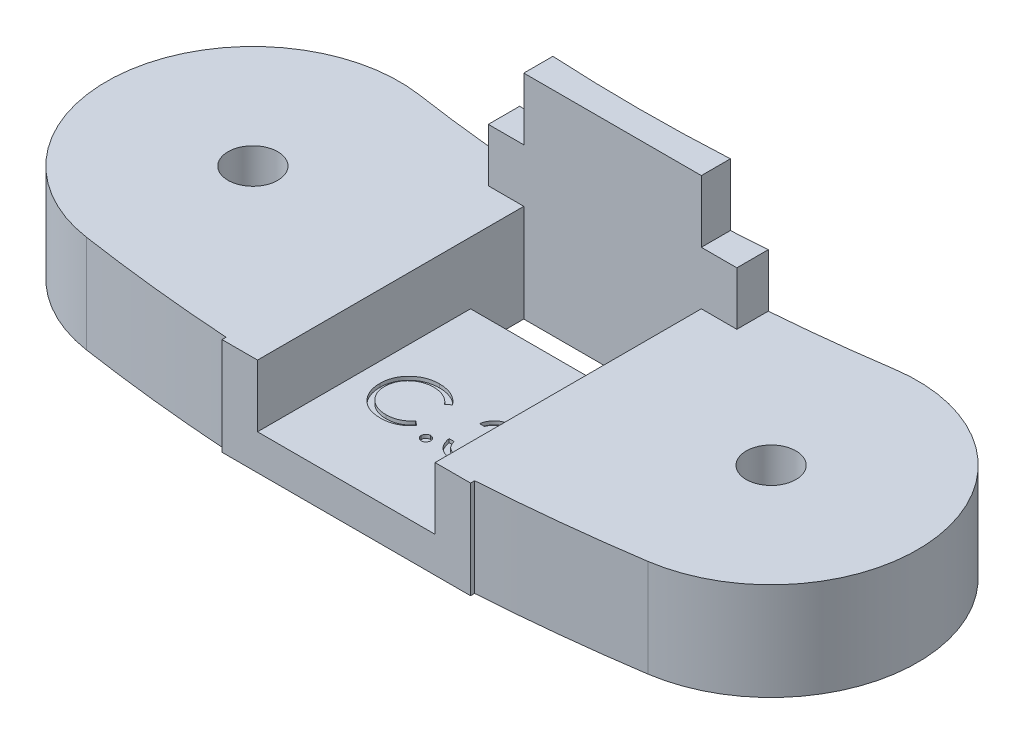
from build123d import *

# Parameters (mm, degrees)
SKETCH2_R                = 1.4
BOSS_EXTRUDE1_DEPTH      = 14
BOSS_EXTRUDE2_REACH      = 34.049
BOSS_EXTRUDE2_END_RADIUS = 107
SKETCH3_W                = 14
SKETCH3_H                = 14
SKETCH19_W               = 15.846179349
SKETCH19_H               = 3
CUT_EXTRUDE4_DEPTH       = 22
CUT_EXTRUDE8_DEPTH       = 33.049477443
SKETCH25_W               = 10
SKETCH25_H               = 3
CUT_EXTRUDE9_DEPTH       = 2
BOSS_EXTRUDE3_DEPTH      = 3
BOSS_EXTRUDE3_DEPTH_BACK = 3.5
BOSS_EXTRUDE4_DEPTH      = 3.5
CUT_EXTRUDE10_DEPTH      = 0.2


with BuildPart() as part:
    # Sketch2 → Boss-Extrude1 (new body)
    with BuildSketch(Plane(origin=(0, 0, 0), x_dir=(1, 0, 0), z_dir=(0, 1, 0))):
        with BuildLine():
            ThreePointArc((-13.376751707, 15.494064366), (0, 14.5), (13.376751707, 15.494064366))
            ThreePointArc((13.376751707, 15.494064366), (22.755560222, 8.554111135), (15.815606991, -0.82469738))
            ThreePointArc((15.815606991, -0.82469738), (0, -2), (-15.815606991, -0.82469738))
            ThreePointArc((-15.815606991, -0.82469738), (-22.755560222, 8.554111135), (-13.376751707, 15.494064366))
        make_face()
        with Locations(Location((-14.596179349, 7.334683493, 0), (0, 0, 270))):
            Circle(SKETCH2_R, mode=Mode.SUBTRACT)
        with Locations(Location((14.596179349, 7.334683493, 0), (0, 0, 270))):
            Circle(SKETCH2_R, mode=Mode.SUBTRACT)
    extrude(amount=BOSS_EXTRUDE1_DEPTH)

    # Boss-Extrude2: up to this cylinder (the profile starts outside it)
    boss_extrude2_end = Plane(origin=(0, 7, -105), z_dir=(0, -1, 0)) * Cylinder(BOSS_EXTRUDE2_END_RADIUS, 283.098, mode=Mode.PRIVATE)
    # Sketch3 → Boss-Extrude2 (add, up to the surface)
    with BuildSketch(Plane.XY.offset(2), mode=Mode.PRIVATE) as boss_extrude2_sk1:
        with Locations((0, 7)):
            Rectangle(SKETCH3_W, SKETCH3_H)
    boss_extrude2_tool1 = extrude(boss_extrude2_sk1.sketch, amount=-BOSS_EXTRUDE2_REACH, mode=Mode.PRIVATE) - boss_extrude2_end
    add(boss_extrude2_tool1.solids().sort_by_distance((0, 7, 2))[0])
    add(boss_extrude2_tool1.solids().sort_by_distance((0, 7, 2))[1])

    # Sketch19 → Cut-Extrude4 (cut)
    with BuildSketch(Plane.XY.offset(2)):
        with Locations((-14.923089674, 7)):
            Rectangle(SKETCH19_W, SKETCH19_H)
    cut_extrude4 = extrude(amount=-CUT_EXTRUDE4_DEPTH, mode=Mode.SUBTRACT)

    # Mirror2: Cut-Extrude4 across plane
    add(cut_extrude4.mirror(Plane(origin=(0, 0, 0), x_dir=(0, 0, 1), z_dir=(1, 0, 0))), mode=Mode.SUBTRACT)

    # Sketch24 → Cut-Extrude8 (cut, through all)
    with BuildSketch(Plane.XY.offset(2)):
        Polygon((-5, 8.5), (-7, 8.5), (-7, 5.5), (-5, 5.5), (-5, 2), (5, 2), (5, 5.5), (7, 5.5), (7, 8.5), (5, 8.5), (5, 12), (-5, 12), align=None)
    extrude(amount=-CUT_EXTRUDE8_DEPTH, mode=Mode.SUBTRACT)


with BuildPart() as cut_extrude8_kept_piece:
    # of the separate pieces the step leaves, the one the design keeps (cut_extrude8_pieces_kept)
    add(part.part.solids().sort_by_distance((-13.376751707, 0, -15.494064366))[0])

    # Sketch25 → Cut-Extrude9 (cut)
    with BuildSketch(Plane(origin=(0, 2, 0), x_dir=(1, 0, 0), z_dir=(0, 1, 0))):
        with Locations((0, 11.5)):
            Rectangle(SKETCH25_W, SKETCH25_H)
    extrude(amount=-CUT_EXTRUDE9_DEPTH, mode=Mode.SUBTRACT)

    # Sketch26 → Boss-Extrude3 (add, two sides: drawn at the far end of the back side and taken through both)
    with BuildSketch(Plane(origin=(0, 5.5, 0), x_dir=(1, 0, 0), z_dir=(0, 1, 0)).offset(-BOSS_EXTRUDE3_DEPTH_BACK)):
        with BuildLine():
            Line((-7, 14.771124356), (-7, 13))
            Line((-7, 13), (-5, 13))
            Line((-5, 13), (-5, 14.638227109))
            ThreePointArc((-5, 14.638227109), (-6.00036794, 14.699138517), (-7, 14.771124356))
        make_face()
        with BuildLine():
            Line((-5, 14.638227109), (-5, 13))
            Line((-5, 13), (0, 13))
            Line((0, 13), (0, 14.5))
            ThreePointArc((0, 14.5), (-2.500955154, 14.534563377), (-5, 14.638227109))
        make_face()
        with BuildLine():
            Line((0, 14.5), (0, 13))
            Line((0, 13), (5, 13))
            Line((5, 13), (7, 13))
            Line((7, 13), (7, 14.771124356))
            ThreePointArc((7, 14.771124356), (6.00036794, 14.699138517), (5, 14.638227109))
            ThreePointArc((5, 14.638227109), (2.500955154, 14.534563377), (0, 14.5))
        make_face()
    extrude(amount=BOSS_EXTRUDE3_DEPTH + BOSS_EXTRUDE3_DEPTH_BACK)

    # Sketch27 → Boss-Extrude4 (add)
    with BuildSketch(Plane(origin=(0, 8.5, 0), x_dir=(1, 0, 0), z_dir=(0, 1, 0))):
        with BuildLine():
            Line((-5, 14.638227109), (-5, 13))
            Line((-5, 13), (5, 13))
            Line((5, 13), (5, 14.638227109))
            ThreePointArc((5, 14.638227109), (0, 14.5), (-5, 14.638227109))
        make_face()
    extrude(amount=BOSS_EXTRUDE4_DEPTH)

    # Sketch28 → Cut-Extrude10 (cut)
    with BuildSketch(Plane(origin=(0, 2, 0), x_dir=(1, 0, 0), z_dir=(0, 1, 0))):
        with BuildLine():
            Line((-0.823224652, 4.80195246), (-1.072543562, 4.611147172))
            add(Edge.make_bspline(
                [(-1.072543562, 4.611147172), (-1.090328904, 4.632343444), (-1.125659802, 4.674450218), (-1.18250065, 4.733577376), (-1.241738569, 4.788972292), (-1.303350915, 4.840898854), (-1.368446688, 4.887541206), (-1.435448983, 4.931329992), (-1.505478639, 4.970580011), (-1.602317712, 5.018171435), (-1.72899826, 5.067834018), (-1.888469293, 5.109474806), (-2.054940075, 5.135982587), (-2.168512183, 5.138853551), (-2.22627954, 5.140313838)],
                knots=[0, 0, 0, 0, 0.757959112, 1.505699292, 2.245454638, 2.979532153, 3.711538275, 4.438200793, 5.171680507, 5.909471876, 7.393775596, 8.890124382, 10.418191784, 12, 12, 12, 12], degree=3))
            add(Edge.make_bspline(
                [(-2.22627954, 5.140313838), (-2.258105104, 5.139947387), (-2.321460862, 5.139217884), (-2.415484834, 5.129593892), (-2.507753102, 5.116067294), (-2.598205647, 5.095996466), (-2.68672733, 5.070621304), (-2.773896867, 5.040299678), (-2.858452196, 5.002784931), (-2.941563027, 4.961321009), (-3.021191311, 4.914487542), (-3.096534104, 4.863403287), (-3.167316618, 4.808639892), (-3.233594845, 4.749992103), (-3.295436541, 4.687724039), (-3.352393601, 4.6211721), (-3.404268938, 4.550549057), (-3.452090811, 4.47678618), (-3.494919504, 4.400098326), (-3.530778752, 4.320201655), (-3.562533399, 4.238464362), (-3.587660569, 4.153962952), (-3.607549238, 4.067292014), (-3.621272189, 3.978218942), (-3.630786731, 3.886929818), (-3.631512606, 3.825054228), (-3.631878498, 3.793864519)],
                knots=[0, 0, 0, 0, 1.054917814, 2.100044995, 3.131103042, 4.146048494, 5.169673617, 6.183595914, 7.203665975, 8.234915748, 9.262203917, 10.264457458, 11.251630812, 12.227803204, 13.197192746, 14.159520551, 15.12972552, 16.100847026, 17.073214652, 18.039054194, 19.002613845, 19.979014051, 20.95965708, 21.949030935, 22.966165397, 24, 24, 24, 24], degree=3))
            add(Edge.make_bspline(
                [(-3.631878498, 3.793864519), (-3.630733848, 3.746936822), (-3.62848648, 3.654800513), (-3.608485491, 3.519844316), (-3.578091587, 3.390557705), (-3.532538885, 3.267748848), (-3.47636946, 3.149903409), (-3.405394048, 3.039015306), (-3.323191904, 2.933408851), (-3.228600109, 2.835579892), (-3.12481769, 2.746213869), (-3.013467799, 2.667518699), (-2.894827766, 2.60191877), (-2.770207538, 2.54733059), (-2.638648134, 2.50536913), (-2.500386135, 2.475828818), (-2.355722254, 2.456559125), (-2.256871441, 2.45471428), (-2.206562994, 2.453775377)],
                knots=[0, 0, 0, 0, 1.029171465, 2.020641659, 2.987623507, 3.938342917, 4.889210282, 5.84687017, 6.821220943, 7.821438502, 8.827599549, 9.822697543, 10.807740252, 11.797342354, 12.80366471, 13.83203677, 14.896651826, 16, 16, 16, 16], degree=3))
            add(Edge.make_bspline(
                [(-2.206562994, 2.453775377), (-2.151134126, 2.455307341), (-2.042036854, 2.458322614), (-1.882045859, 2.483867076), (-1.7288877, 2.52528533), (-1.582554139, 2.583249873), (-1.44345771, 2.658601956), (-1.31138074, 2.749949316), (-1.186211744, 2.858160875), (-1.110944938, 2.940786285), (-1.072543562, 2.982942044)],
                knots=[0, 0, 0, 0, 1.028121516, 2.023589091, 2.998037872, 3.967518031, 4.937445131, 5.927275754, 6.942489185, 8, 8, 8, 8], degree=3))
            Line((-1.072543562, 2.982942044), (-0.823224652, 2.794044808))
            add(Edge.make_bspline(
                [(-0.823224652, 2.794044808), (-0.843288938, 2.768156355), (-0.883321402, 2.716503454), (-0.948144031, 2.643685546), (-1.016431294, 2.575192599), (-1.088690402, 2.511576828), (-1.164090113, 2.451565277), (-1.243984282, 2.396862902), (-1.327322619, 2.346706171), (-1.413822753, 2.300780318), (-1.503392781, 2.260033958), (-1.595925375, 2.225150898), (-1.691021683, 2.195101891), (-1.788686051, 2.170380491), (-1.889121059, 2.151084579), (-1.991964275, 2.138185303), (-2.097437662, 2.129347995), (-2.168595237, 2.128542528), (-2.204654941, 2.128134351)],
                knots=[0, 0, 0, 0, 0.986787822, 1.968848986, 2.935600012, 3.899624008, 4.868462664, 5.837806735, 6.815139263, 7.798259679, 8.787526145, 9.778297419, 10.776456485, 11.791383307, 12.812564526, 13.85620153, 14.913611965, 16, 16, 16, 16], degree=3))
            add(Edge.make_bspline(
                [(-2.204654941, 2.128134351), (-2.238803124, 2.128372016), (-2.306326929, 2.128841968), (-2.406020797, 2.136454863), (-2.503075631, 2.14684141), (-2.597214041, 2.162480672), (-2.688949747, 2.180935895), (-2.777451134, 2.20567482), (-2.863589075, 2.233387279), (-2.947017499, 2.265958231), (-3.027807369, 2.302712196), (-3.105698112, 2.344251682), (-3.180653905, 2.390227373), (-3.253411679, 2.439625847), (-3.32289663, 2.494033828), (-3.389710899, 2.552695704), (-3.454229146, 2.615413756), (-3.494145867, 2.660639231), (-3.514215237, 2.683377741)],
                knots=[0, 0, 0, 0, 1.114604814, 2.203992996, 3.262667896, 4.300477797, 5.318619304, 6.316056647, 7.298880507, 8.271930387, 9.238335007, 10.195173496, 11.151986948, 12.108099108, 13.064862484, 14.031167946, 15.010108607, 16, 16, 16, 16], degree=3))
            add(Edge.make_bspline(
                [(-3.514215237, 2.683377741), (-3.546360428, 2.722875819), (-3.610262725, 2.801395121), (-3.692019595, 2.928654547), (-3.762003449, 3.061522136), (-3.81858732, 3.200695929), (-3.862822085, 3.34586363), (-3.893466455, 3.497098418), (-3.913379696, 3.654259051), (-3.915656886, 3.761153852), (-3.916814396, 3.815489119)],
                knots=[0, 0, 0, 0, 0.994628077, 1.977248131, 2.950237994, 3.925870899, 4.908910175, 5.911660606, 6.938484602, 8, 8, 8, 8], degree=3))
            add(Edge.make_bspline(
                [(-3.916814396, 3.815489119), (-3.915403613, 3.872598709), (-3.912627986, 3.984958262), (-3.889046086, 4.149853205), (-3.851110464, 4.307833403), (-3.797229, 4.458603942), (-3.728916289, 4.602957839), (-3.644527861, 4.739792361), (-3.545044096, 4.869982601), (-3.431245231, 4.991553125), (-3.306452005, 5.102713824), (-3.172812796, 5.200509451), (-3.030589172, 5.281896055), (-2.881347978, 5.349928288), (-2.723971681, 5.402220051), (-2.558796054, 5.438826156), (-2.386131467, 5.461610969), (-2.268327695, 5.464491336), (-2.208471046, 5.465954864)],
                knots=[0, 0, 0, 0, 1.032925535, 2.032216505, 3.007276963, 3.968222605, 4.92396291, 5.891752235, 6.871517503, 7.883894988, 8.900124299, 9.891468569, 10.874487609, 11.85992873, 12.854644235, 13.869047385, 14.917252991, 16, 16, 16, 16], degree=3))
            add(Edge.make_bspline(
                [(-2.208471046, 5.465954864), (-2.171990775, 5.465517496), (-2.099781753, 5.464651769), (-1.992963275, 5.456209769), (-1.888966307, 5.442136712), (-1.787719202, 5.42298142), (-1.6887294, 5.399207636), (-1.592753468, 5.368237508), (-1.49922823, 5.332825797), (-1.408743535, 5.292042046), (-1.321733522, 5.246261502), (-1.23822529, 5.195991615), (-1.158882168, 5.141294706), (-1.083145855, 5.082635968), (-1.012283293, 5.018774418), (-0.944282523, 4.951466599), (-0.88145283, 4.878773772), (-0.842669575, 4.82760644), (-0.823224652, 4.80195246)],
                knots=[0, 0, 0, 0, 1.096760587, 2.17092713, 3.219439832, 4.250915756, 5.268269357, 6.278326846, 7.281116186, 8.274029601, 9.260640565, 10.235837813, 11.203064059, 12.156899882, 13.114053108, 14.069676657, 15.032185724, 16, 16, 16, 16], degree=3))
        make_face()
        with BuildLine():
            add(Edge.make_bspline(
                [(0.051935604, 2.698006146), (0.069616011, 2.696955523), (0.104276381, 2.694895901), (0.154386162, 2.680765632), (0.199738461, 2.655675276), (0.240135568, 2.62223547), (0.273433586, 2.581690118), (0.299418106, 2.536699544), (0.313425285, 2.486170242), (0.315469905, 2.451309037), (0.316518938, 2.433422813)],
                knots=[0, 0, 0, 0, 1.020151414, 1.999887582, 2.974338812, 3.990962822, 5.007586832, 5.987933904, 6.967670073, 8, 8, 8, 8], degree=3))
            add(Edge.make_bspline(
                [(0.316518938, 2.433422813), (0.315434357, 2.415966364), (0.31329558, 2.381542502), (0.299450214, 2.331394318), (0.273235554, 2.286375626), (0.240365239, 2.245280115), (0.199728474, 2.211769468), (0.154278942, 2.186892577), (0.104394015, 2.171750567), (0.069635636, 2.169821712), (0.051935604, 2.168839479)],
                knots=[0, 0, 0, 0, 1.009421747, 1.99056486, 2.972319754, 3.999869655, 5.017953583, 5.993804169, 6.978383603, 8, 8, 8, 8], degree=3))
            add(Edge.make_bspline(
                [(0.051935604, 2.168839479), (0.034222818, 2.169786171), (-0.000357179, 2.171634361), (-0.050055903, 2.187203478), (-0.095782224, 2.211536189), (-0.136411077, 2.2453426), (-0.169556691, 2.286164158), (-0.194616859, 2.331704359), (-0.209666494, 2.381398949), (-0.211645765, 2.415938089), (-0.212647729, 2.433422813)],
                knots=[0, 0, 0, 0, 1.022052826, 1.995314843, 2.982371812, 4.00089066, 5.028879526, 6.005146991, 6.990147033, 8, 8, 8, 8], degree=3))
            add(Edge.make_bspline(
                [(-0.212647729, 2.433422813), (-0.211684253, 2.451338321), (-0.209803185, 2.486316153), (-0.194585265, 2.536389629), (-0.16975113, 2.581899571), (-0.13618195, 2.622173611), (-0.095792053, 2.655907807), (-0.05016621, 2.680459441), (-0.000237484, 2.695010386), (0.03424296, 2.696990241), (0.051935604, 2.698006146)],
                knots=[0, 0, 0, 0, 1.032775665, 2.016367738, 2.991239715, 4.008302682, 5.025365648, 6.011011707, 6.979408107, 8, 8, 8, 8], degree=3))
        make_face()
        with BuildLine():
            Line((1.130621502, 4.6518523), (0.845685604, 4.6518523))
            add(Edge.make_bspline(
                [(0.845685604, 4.6518523), (0.853404982, 4.683813196), (0.868495735, 4.746294134), (0.899971391, 4.835563578), (0.934260715, 4.920039915), (0.975435117, 4.998141353), (1.02034663, 5.071437501), (1.071802242, 5.138265921), (1.12742799, 5.200326254), (1.188954908, 5.255401834), (1.253478766, 5.305274488), (1.321908742, 5.347796861), (1.392868082, 5.384376629), (1.466848424, 5.414512125), (1.544070022, 5.43721385), (1.623834752, 5.453684666), (1.706351641, 5.464380891), (1.762365527, 5.465424798), (1.7908078, 5.465954864)],
                knots=[0, 0, 0, 0, 1.162005537, 2.271625781, 3.343758855, 4.383309926, 5.390229558, 6.379919256, 7.361854164, 8.333198761, 9.295911338, 10.242430842, 11.177959212, 12.116337295, 13.062827104, 14.020064771, 14.994644689, 16, 16, 16, 16], degree=3))
            add(Edge.make_bspline(
                [(1.7908078, 5.465954864), (1.832248573, 5.464703705), (1.914226176, 5.462228679), (2.034661225, 5.439627726), (2.15079984, 5.403863499), (2.2613708, 5.354448046), (2.364076093, 5.293499555), (2.455458205, 5.220960115), (2.534278497, 5.13822932), (2.600404111, 5.046850494), (2.652179289, 4.949191567), (2.690357642, 4.848679996), (2.713600167, 4.745554208), (2.716612386, 4.67592439), (2.718121502, 4.64104)],
                knots=[0, 0, 0, 0, 1.083050992, 2.142477498, 3.193116406, 4.255571735, 5.30263384, 6.308962982, 7.297363603, 8.282367274, 9.249857812, 10.179914175, 11.08814088, 12, 12, 12, 12], degree=3))
            add(Edge.make_bspline(
                [(2.718121502, 4.64104), (2.717065958, 4.607469551), (2.715000424, 4.541777391), (2.697461991, 4.44587289), (2.667946952, 4.355483724), (2.627062239, 4.270229384), (2.574138119, 4.190650422), (2.510027887, 4.116567792), (2.434279043, 4.047652913), (2.376876007, 4.008174534), (2.347323224, 3.987849896)],
                knots=[0, 0, 0, 0, 1.024540389, 2.004866551, 2.965041327, 3.920577974, 4.882998113, 5.874504559, 6.905732034, 8, 8, 8, 8], degree=3))
            add(Edge.make_bspline(
                [(2.347323224, 3.987849896), (2.381097745, 3.971541126), (2.448014838, 3.939228736), (2.539228532, 3.875859585), (2.622030605, 3.802692755), (2.66820755, 3.745594777), (2.691408761, 3.716906386)],
                knots=[0, 0, 0, 0, 1.015518401, 2.012035669, 3.001164323, 4, 4, 4, 4], degree=3))
            add(Edge.make_bspline(
                [(2.691408761, 3.716906386), (2.706686265, 3.695989712), (2.736991092, 3.654498887), (2.774397612, 3.587790844), (2.808333023, 3.520343422), (2.834776436, 3.450348818), (2.855254158, 3.378618298), (2.869891844, 3.305028696), (2.878985172, 3.229519918), (2.880287423, 3.178436454), (2.880942014, 3.15275875)],
                knots=[0, 0, 0, 0, 1.025084078, 2.033381695, 3.024893161, 4.013698104, 4.991890475, 5.976764909, 6.982997093, 8, 8, 8, 8], degree=3))
            add(Edge.make_bspline(
                [(2.880942014, 3.15275875), (2.879314134, 3.108299932), (2.876066035, 3.019591519), (2.847033767, 2.888532307), (2.802027471, 2.760420601), (2.738112964, 2.637888426), (2.660218867, 2.523243366), (2.56754758, 2.420667), (2.461152053, 2.33249398), (2.342492642, 2.258824702), (2.213934962, 2.199934872), (2.076434246, 2.159061335), (1.931971697, 2.132440321), (1.832905077, 2.129585661), (1.782539571, 2.128134351)],
                knots=[0, 0, 0, 0, 0.955779014, 1.907060117, 2.875433937, 3.871313158, 4.872415639, 5.851225146, 6.836215519, 7.83643374, 8.849228613, 9.86973379, 10.916971861, 12, 12, 12, 12], degree=3))
            add(Edge.make_bspline(
                [(1.782539571, 2.128134351), (1.74859492, 2.128921945), (1.681803166, 2.130471666), (1.583610849, 2.141065826), (1.489883308, 2.160415187), (1.400493815, 2.186453186), (1.315362961, 2.219465695), (1.234750523, 2.260576228), (1.158160548, 2.308937376), (1.086315785, 2.365119988), (1.019224799, 2.427968061), (0.958670542, 2.498597305), (0.903643444, 2.575702093), (0.855616907, 2.660178008), (0.812403386, 2.750933349), (0.776860661, 2.849130201), (0.745577324, 2.953890707), (0.731032681, 3.026895514), (0.72357022, 3.0643523)],
                knots=[0, 0, 0, 0, 1.048658725, 2.063410685, 3.046034179, 4.001477787, 4.936774919, 5.862367409, 6.792675028, 7.730719943, 8.675894397, 9.627829632, 10.600096036, 11.597688215, 12.626045268, 13.701542398, 14.82072376, 16, 16, 16, 16], degree=3))
            Line((0.72357022, 3.0643523), (1.008506117, 3.0643523))
            add(Edge.make_bspline(
                [(1.008506117, 3.0643523), (1.015929531, 3.039905695), (1.030368717, 2.992354925), (1.054947116, 2.923919791), (1.082949049, 2.861183557), (1.112988684, 2.80368601), (1.144537703, 2.750860902), (1.179839099, 2.704105064), (1.216278252, 2.661364845), (1.243745951, 2.63728509), (1.25718901, 2.625500136)],
                knots=[0, 0, 0, 0, 1.198163088, 2.33053128, 3.407730985, 4.417276592, 5.372219308, 6.28897303, 7.162600585, 8, 8, 8, 8], degree=3))
            add(Edge.make_bspline(
                [(1.25718901, 2.625500136), (1.274965904, 2.611794719), (1.31046482, 2.58442619), (1.368311715, 2.549499713), (1.429149147, 2.519236497), (1.494295316, 2.496119145), (1.562344429, 2.476545124), (1.634396396, 2.463735796), (1.709815543, 2.45494724), (1.761312014, 2.454171695), (1.787627712, 2.453775377)],
                knots=[0, 0, 0, 0, 0.946170439, 1.889420265, 2.845303464, 3.807233317, 4.801018734, 5.828864929, 6.890507805, 8, 8, 8, 8], degree=3))
            add(Edge.make_bspline(
                [(1.787627712, 2.453775377), (1.817339818, 2.454334091), (1.875439276, 2.455426608), (1.960216184, 2.465473856), (2.04086794, 2.480106446), (2.116499094, 2.50270608), (2.18810034, 2.53062871), (2.254667979, 2.565688335), (2.317075876, 2.606822475), (2.374524693, 2.653575855), (2.426182404, 2.704758211), (2.471666105, 2.758291497), (2.510332762, 2.813949999), (2.54152358, 2.872041723), (2.566153007, 2.932326109), (2.582919911, 2.994972333), (2.594578071, 3.05946771), (2.595527498, 3.103308989), (2.596006117, 3.125409992)],
                knots=[0, 0, 0, 0, 1.217147791, 2.380027433, 3.494444702, 4.572153297, 5.609568379, 6.639424714, 7.649109417, 8.668170816, 9.669597737, 10.625200337, 11.543417969, 12.441394052, 13.322311151, 14.205496177, 15.095365482, 16, 16, 16, 16], degree=3))
            add(Edge.make_bspline(
                [(2.596006117, 3.125409992), (2.594617915, 3.154993135), (2.591848418, 3.21401222), (2.570704207, 3.300841734), (2.53592538, 3.384501544), (2.487236745, 3.463564296), (2.427967905, 3.536839578), (2.358694025, 3.602218709), (2.278839847, 3.656166577), (2.205343251, 3.693439858), (2.140242002, 3.718873491), (2.084529475, 3.735814351), (2.022157413, 3.750159596), (1.953880083, 3.763505728), (1.879183022, 3.77486438), (1.798147553, 3.784336598), (1.710757255, 3.791915814), (1.65025884, 3.79530045), (1.61908304, 3.797044608)],
                knots=[0, 0, 0, 0, 1.07054697, 2.135767047, 3.216561865, 4.33974944, 5.486079747, 6.621378074, 7.775625952, 8.963672916, 9.598146892, 10.304877434, 11.070270905, 11.915000392, 12.823868403, 13.805723172, 14.86925407, 16, 16, 16, 16], degree=3))
            Line((1.61908304, 3.797044608), (1.61908304, 4.122685633))
            add(Edge.make_bspline(
                [(1.61908304, 4.122685633), (1.658363383, 4.123352205), (1.735303926, 4.124657856), (1.84769376, 4.140449408), (1.955165979, 4.162293978), (2.055338809, 4.195754117), (2.14664157, 4.234616386), (2.225852924, 4.279839462), (2.291863122, 4.330108556), (2.344351379, 4.386199566), (2.383838608, 4.446356787), (2.41271006, 4.50905547), (2.429764642, 4.574845153), (2.432041268, 4.619743888), (2.433185604, 4.642312035)],
                knots=[0, 0, 0, 0, 1.321986639, 2.589447074, 3.816329219, 5.01088745, 6.139805852, 7.153945165, 8.075214402, 8.924034688, 9.728124013, 10.488707548, 11.240355623, 12, 12, 12, 12], degree=3))
            add(Edge.make_bspline(
                [(2.433185604, 4.642312035), (2.432809674, 4.658892561), (2.432061779, 4.691878731), (2.422629963, 4.740070758), (2.408456726, 4.786789473), (2.388971543, 4.831836201), (2.362891006, 4.874898521), (2.331679861, 4.916343564), (2.294515941, 4.955934706), (2.251929714, 4.992837568), (2.206199005, 5.028006804), (2.156079567, 5.057864175), (2.10308258, 5.083395767), (2.047149372, 5.104450101), (1.988098427, 5.12028817), (1.926207192, 5.131659969), (1.861357651, 5.138769841), (1.817114722, 5.139793476), (1.794623905, 5.140313838)],
                knots=[0, 0, 0, 0, 0.884392785, 1.759457502, 2.611959086, 3.489218968, 4.37281399, 5.2945488, 6.255912374, 7.266815255, 8.301784654, 9.332968512, 10.37626691, 11.440494194, 12.520033166, 13.637162961, 14.798855837, 16, 16, 16, 16], degree=3))
            add(Edge.make_bspline(
                [(1.794623905, 5.140313838), (1.758472749, 5.139051674), (1.687861134, 5.136586374), (1.586066173, 5.114993641), (1.491433635, 5.080542093), (1.419099273, 5.039418569), (1.365684366, 4.998823532), (1.327514572, 4.963370225), (1.290030967, 4.923970449), (1.255699531, 4.878197494), (1.220979567, 4.829151192), (1.189370571, 4.77433828), (1.158654993, 4.71518858), (1.140146966, 4.673373254), (1.130621502, 4.6518523)],
                knots=[0, 0, 0, 0, 1.472543308, 2.876219568, 4.221790263, 5.565193594, 6.249813518, 6.953379497, 7.687249741, 8.463570142, 9.283606569, 10.136032583, 11.040678096, 12, 12, 12, 12], degree=3))
        make_face()
    extrude(amount=-CUT_EXTRUDE10_DEPTH, mode=Mode.SUBTRACT)


solid = cut_extrude8_kept_piece.part
